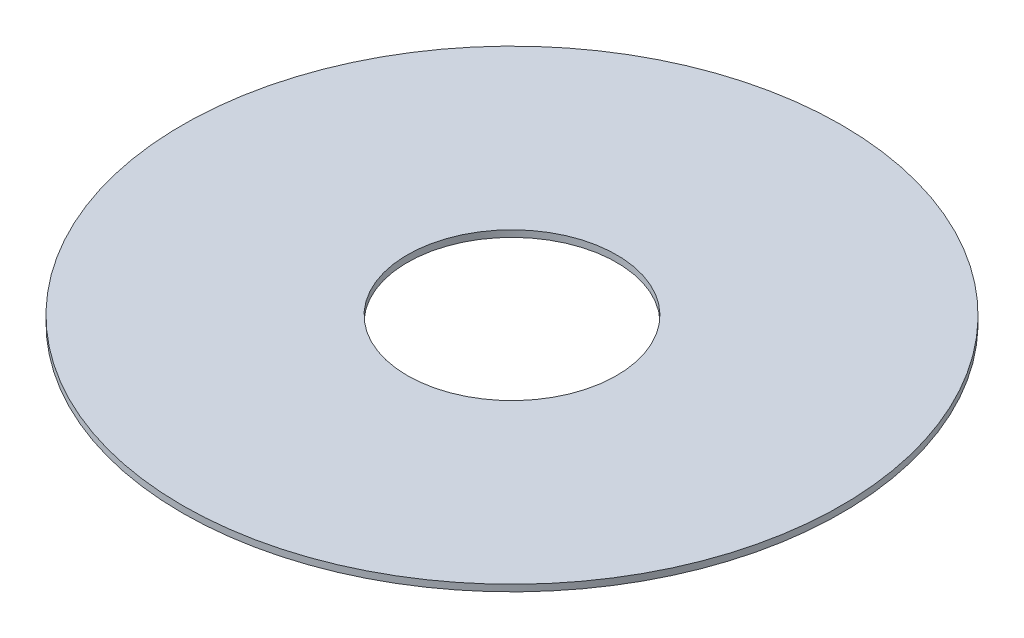
from build123d import *

# Parameters (mm, degrees)
SKETCH1_R           = 100
SKETCH1_R_2         = 31.75
BOSS_EXTRUDE1_DEPTH = 2


with BuildPart() as part:
    # Sketch1 → Boss-Extrude1 (new body)
    with BuildSketch(Plane(origin=(0, 0, 0), x_dir=(1, 0, 0), z_dir=(0, 1, 0))):
        with Locations(Location((0, 0, 0), (0, 0, 270))):
            Circle(SKETCH1_R)
        with Locations(Location((0, 0, 0), (0, 0, 270))):
            Circle(SKETCH1_R_2, mode=Mode.SUBTRACT)
    extrude(amount=BOSS_EXTRUDE1_DEPTH)


solid = part.part
